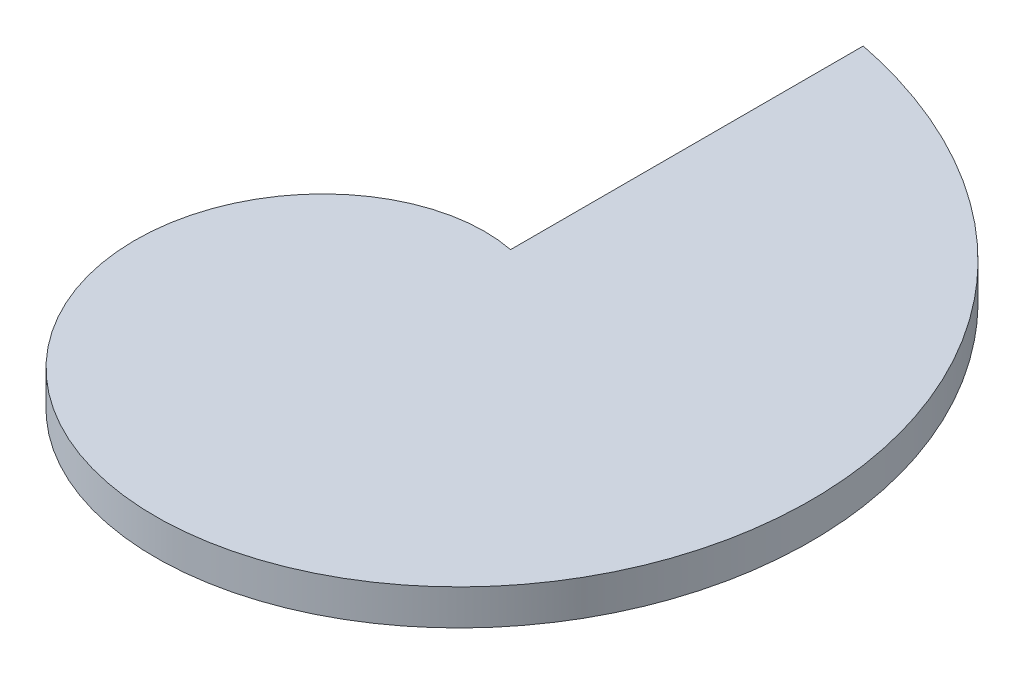
from build123d import *

# Parameters (mm, degrees)
BOSS_EXTRUDE2_DEPTH = 3


with BuildPart() as part:
    # Sketch1 → Boss-Extrude2 (new body)
    with BuildSketch(Plane(origin=(0, 0, 0), x_dir=(1, 0, 0), z_dir=(0, 1, 0))):
        with BuildLine():
            Line((0, 41.571131842), (0, 11.831852393))
            add(Edge.make_bspline(
                [(0, 11.831852393), (-0.102074489, 11.852272188), (-0.52031487, 11.930948032), (-1.260759255, 12.034607757), (-2.329325412, 12.096608945), (-3.616057806, 12.03916826), (-4.89044623, 11.852920845), (-6.140253636, 11.542238771), (-7.354185147, 11.112457347), (-8.52192279, 10.569740632), (-9.63413488, 9.92092499), (-10.944575509, 8.986546348), (-12.374667495, 7.683558604), (-13.807464436, 5.934200639), (-15.085504031, 3.689042496), (-15.981417763, 1.266727341), (-16.484697906, -1.265752037), (-16.595500654, -3.844764718), (-16.323097074, -6.411165993), (-15.684381714, -8.911178563), (-14.456951497, -11.893218566), (-12.353390747, -15.15929857), (-9.118336188, -18.358211882), (-3.907897826, -21.416500356), (3.263069996, -23.190723542), (10.682054262, -22.418126513), (17.404848334, -19.376018715), (22.422179675, -15.294702074), (25.757056621, -11.340838515), (28.327679697, -6.855229419), (30.081859995, -1.993527429), (30.99701622, 3.091409731), (31.076106998, 8.256098327), (30.435271603, 12.728785502), (29.405252589, 16.454943581), (28.244041513, 19.455530308), (27.141078059, 21.781145216), (25.55537233, 24.580513786), (23.70846681, 27.21922194), (21.62376472, 29.673870118), (19.326266694, 31.925654176), (17.370761849, 33.598714454), (15.308102623, 35.137630188), (13.148676354, 36.537456902), (10.902955527, 37.794052285), (8.581288841, 38.904062694), (6.492515128, 39.744748274), (4.667439695, 40.370901902), (3.280863084, 40.783464733), (2.349504514, 41.034732519), (1.647872355, 41.208753133), (1.177725477, 41.318987918), (0.785977656, 41.406678593), (0.47996013, 41.472857839), (0.20861731, 41.528991647), (0.068852275, 41.557360167), (0, 41.571131842)],
                knots=[0.084949589, 0.084949589, 0.084949589, 0.084949589, 0.084949589, 0.087221827, 0.094238489, 0.101255151, 0.108271814, 0.115288471, 0.122305129, 0.129321787, 0.136338445, 0.143355105, 0.150371766, 0.164405088, 0.17843842, 0.192471752, 0.206505089, 0.220538426, 0.234571786, 0.248605145, 0.262638498, 0.276671851, 0.304738507, 0.332805129, 0.360871888, 0.407262735, 0.463396073, 0.491462766, 0.519529459, 0.547596104, 0.575662749, 0.603729402, 0.631796054, 0.659862693, 0.687929332, 0.701962701, 0.71599607, 0.730029439, 0.744062808, 0.772129495, 0.786162838, 0.800196181, 0.814229518, 0.828262855, 0.842296192, 0.856329529, 0.870362906, 0.884396283, 0.891412972, 0.89842966, 0.901938005, 0.905446349, 0.907200521, 0.908954693, 0.910708865, 0.912459619, 0.912459619, 0.912459619, 0.912459619, 0.912459619], degree=4))
        make_face()
    extrude(amount=BOSS_EXTRUDE2_DEPTH)


solid = part.part
